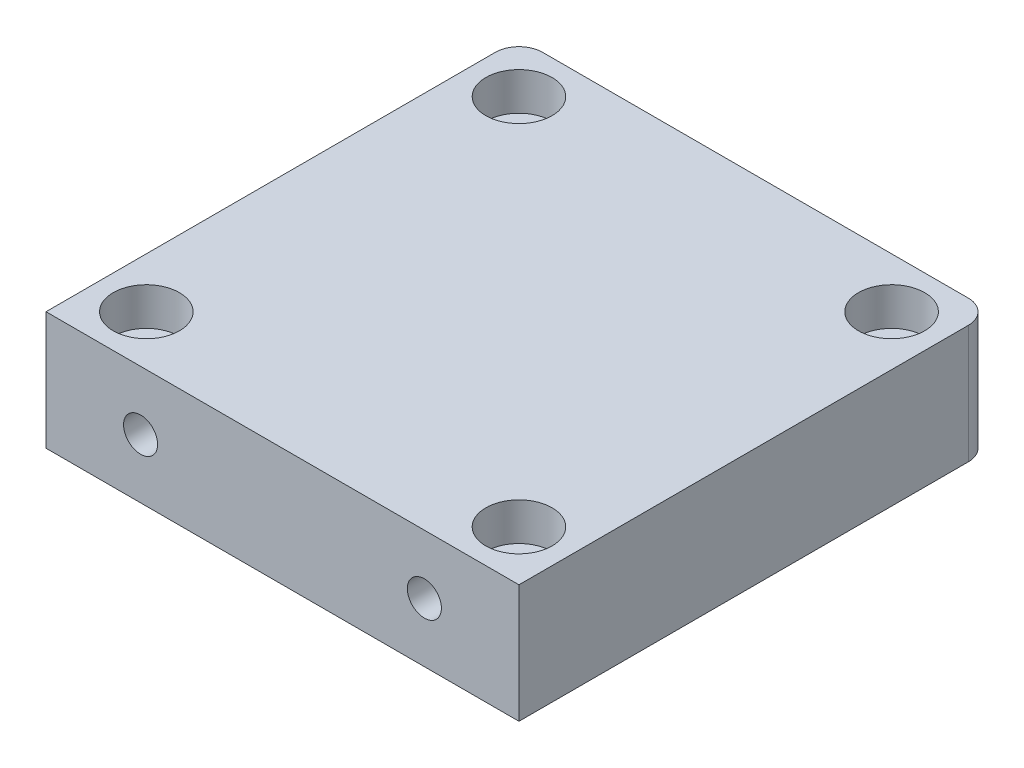
from build123d import *

# Parameters (mm, degrees)
SKETCH1_W           = 100
SKETCH1_H           = 100
SKETCH1_R           = 4
BOSS_EXTRUDE1_DEPTH = 25
SKETCH2_R           = 3.6
CUT_EXTRUDE1_DEPTH  = 20
FILLET1_R           = 5
CUT_EXTRUDE3_START  = 17
SKETCH1_3_R         = 7
CUT_EXTRUDE3_DEPTH  = 8


with BuildPart() as part:
    # Sketch1 → Boss-Extrude1 (new body)
    with BuildSketch(Plane(origin=(0, 0, 0), x_dir=(1, 0, 0), z_dir=(0, 1, 0))):
        with Locations((50, 50)):
            Rectangle(SKETCH1_W, SKETCH1_H)
        with Locations(Location((10.606601718, 89.393398282, 0), (0, 0, 270))):
            Circle(SKETCH1_R, mode=Mode.SUBTRACT)
        with Locations(Location((89.393398282, 89.393398282, 0), (0, 0, 270))):
            Circle(SKETCH1_R, mode=Mode.SUBTRACT)
        with Locations(Location((89.393398282, 10.606601718, 0), (0, 0, 270))):
            Circle(SKETCH1_R, mode=Mode.SUBTRACT)
        with Locations(Location((10.606601718, 10.606601718, 0), (0, 0, 270))):
            Circle(SKETCH1_R, mode=Mode.SUBTRACT)
    extrude(amount=BOSS_EXTRUDE1_DEPTH)

    # Sketch2 → Cut-Extrude1 (cut)
    with BuildSketch(Plane.XY):
        with Locations((20, 12.5)):
            Circle(SKETCH2_R)
        with Locations((80, 12.5)):
            Circle(SKETCH2_R)
    extrude(amount=-CUT_EXTRUDE1_DEPTH, mode=Mode.SUBTRACT)

    # Fillet1
    fillet1_edges = [part.edges().sort_by_distance(p)[0] for p in [
        (100, 12.5, -100),
        (0, 12.5, -100),
    ]]
    fillet(fillet1_edges, radius=FILLET1_R)

    # Sketch1<3> → Cut-Extrude3 (cut)
    with BuildSketch(Plane(origin=(0, 0, 0), x_dir=(1, 0, 0), z_dir=(0, 1, 0)).offset(CUT_EXTRUDE3_START)):
        with Locations(Location((10.606601718, 89.393398282, 0), (0, 0, 90))):
            Circle(SKETCH1_3_R)
        with Locations(Location((89.393398282, 89.393398282, 0), (0, 0, 90))):
            Circle(SKETCH1_3_R)
        with Locations(Location((10.606601718, 10.606601718, 0), (0, 0, 90))):
            Circle(SKETCH1_3_R)
        with Locations(Location((89.393398282, 10.606601718, 0), (0, 0, 90))):
            Circle(SKETCH1_3_R)
    extrude(amount=CUT_EXTRUDE3_DEPTH, mode=Mode.SUBTRACT)


solid = part.part
